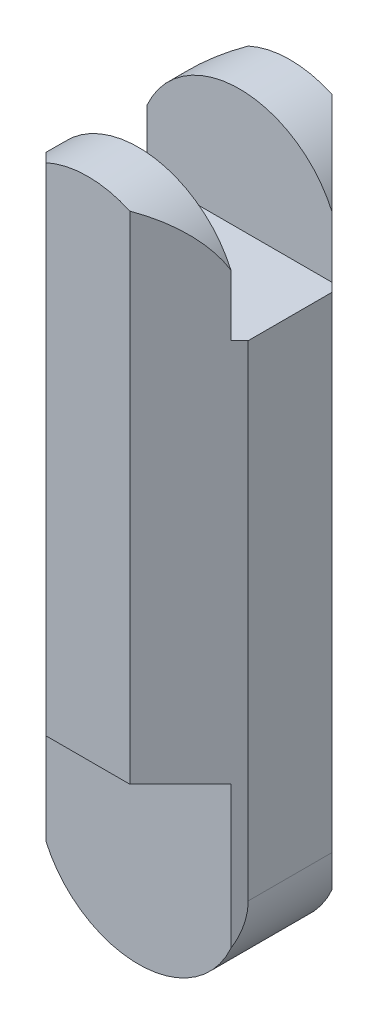
from build123d import *

# Parameters (mm, degrees)
EXTRUDE_1_DEPTH     = 78
CUT_EXTRUDE_1_DEPTH = 66
CUT_EXTRUDE_2_DEPTH = 5
CUT_EXTRUDE_START   = -5
CUT_EXTRUDE_3_DEPTH = 5
SKETCH_6_W          = 20
SKETCH_6_H          = 20
CUT_EXTRUDE_4_DEPTH = 5
CUT_EXTRUDE_5_DEPTH = 30


with BuildPart() as part:
    # 草图1 → 凸台-拉伸1 (new body)
    with BuildSketch(Plane(origin=(0, 0, 0), x_dir=(1, 0, 0), z_dir=(0, 1, 0))):
        Polygon((10, 4.142135624), (4.142135624, 10), (-4.142135624, 10), (-10, 4.142135624), (-10, -4.142135624), (-4.142135624, -10), (4.142135624, -10), (10, -4.142135624), align=None)
    extrude(amount=EXTRUDE_1_DEPTH)

    # 草图2 → 切除-拉伸1 (cut)
    with BuildSketch(Plane.XY.offset(10)):
        with BuildLine():
            Line((-10, 10), (-10, -2.389295552))
            Line((-10, -2.389295552), (10, -2.389295552))
            Line((10, -2.389295552), (10, 10))
            ThreePointArc((10, 10), (0, 0), (-10, 10))
        make_face()
    extrude(amount=-CUT_EXTRUDE_1_DEPTH, mode=Mode.SUBTRACT)

    # 草图4 → 切除-拉伸2 (cut)
    with BuildSketch(Plane.XY.offset(10)):
        with BuildLine():
            Line((-10, 10), (-10, 20))
            Line((-10, 20), (10, 20))
            Line((10, 20), (10, 10))
            ThreePointArc((10, 10), (0, 0), (-10, 10))
        make_face()
    extrude(amount=-CUT_EXTRUDE_2_DEPTH, mode=Mode.SUBTRACT)

    # 草图5 → 切除-拉伸3 (cut)
    with BuildSketch(Plane(origin=(0, 0, -10), x_dir=(-1, 0, 0), z_dir=(0, 0, -1)).offset(CUT_EXTRUDE_START)):
        with BuildLine():
            Line((-10, 10), (-10, 20))
            Line((-10, 20), (10, 20))
            Line((10, 20), (10, 10))
            ThreePointArc((10, 10), (0, 0), (-10, 10))
        make_face()
    extrude(amount=CUT_EXTRUDE_3_DEPTH, mode=Mode.SUBTRACT)

    # 草图6 → 切除-拉伸4 (cut, symmetric)
    with BuildSketch(Plane.XY):
        with Locations((0, 68)):
            Rectangle(SKETCH_6_W, SKETCH_6_H)
    extrude(amount=CUT_EXTRUDE_4_DEPTH, both=True, mode=Mode.SUBTRACT)

    # 草图7 → 切除-拉伸5 (cut)
    with BuildSketch(Plane.XY.offset(10)):
        with BuildLine():
            Line((-10, 60), (-10, 79.107913371))
            Line((-10, 79.107913371), (10, 79.107913371))
            Line((10, 79.107913371), (10, 60))
            ThreePointArc((10, 60), (0, 70), (-10, 60))
        make_face()
    extrude(amount=-CUT_EXTRUDE_5_DEPTH, mode=Mode.SUBTRACT)


solid = part.part
